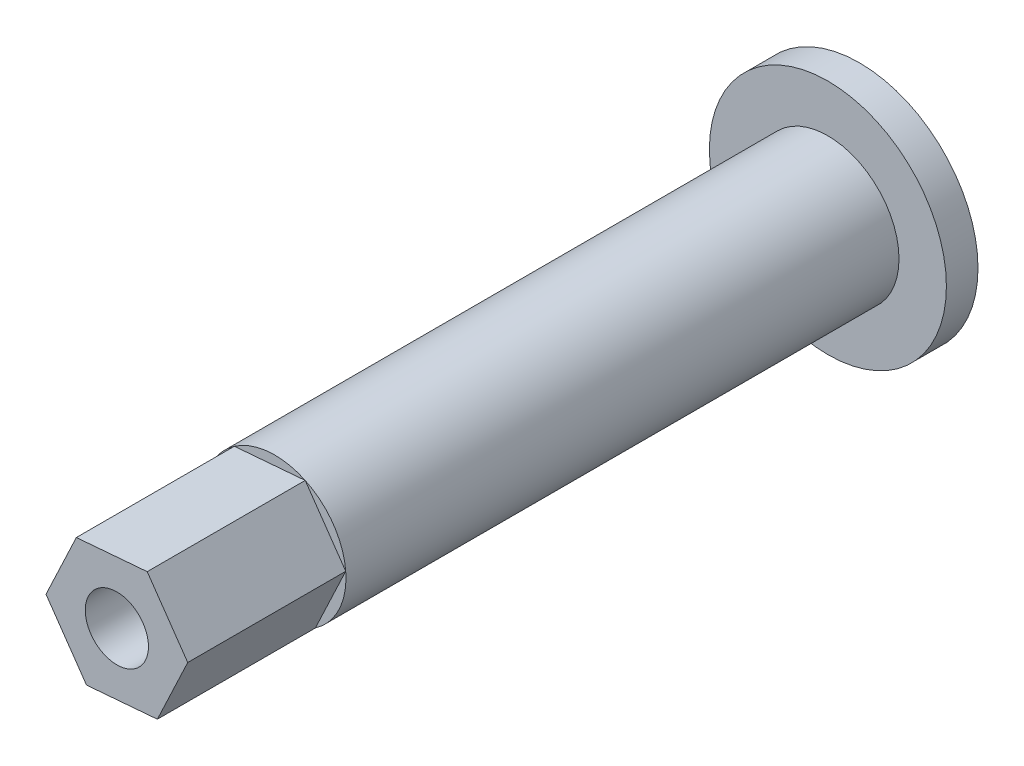
from build123d import *

# Parameters (mm, degrees)
SKETCH1_R           = 4.5
BOSS_EXTRUDE1_DEPTH = 10
BOSS_EXTRUDE2_START = 2
SKETCH2_R           = 7.5
BOSS_EXTRUDE2_DEPTH = 2
SKETCH3_R           = 4.5
BOSS_EXTRUDE3_DEPTH = 25
BOSS_EXTRUDE4_DEPTH = 10
SKETCH5_R           = 2
CUT_EXTRUDE1_DEPTH  = 6


with BuildPart() as part:
    # Sketch1 → Boss-Extrude1 (new body)
    with BuildSketch(Plane.XY):
        Circle(SKETCH1_R)
        with BuildLine():
            Line((-1.85, 1.966596044), (-1.85, -1.966596044))
            ThreePointArc((-1.85, -1.966596044), (0, -2.7), (1.85, -1.966596044))
            Line((1.85, -1.966596044), (1.85, 1.966596044))
            ThreePointArc((1.85, 1.966596044), (1.851058142, 1.9656001), (1.852115749, 1.964603587))
            ThreePointArc((1.852115749, 1.964603587), (0.001453124, 2.699999609), (-1.85, 1.966596044))
        make_face(mode=Mode.SUBTRACT)
    extrude(amount=BOSS_EXTRUDE1_DEPTH)

    # Sketch2 → Boss-Extrude2 (add)
    with BuildSketch(Plane(origin=(0, 0, 0), x_dir=(-1, 0, 0), z_dir=(0, 0, -1)).offset(BOSS_EXTRUDE2_START)):
        Circle(SKETCH2_R)
        with BuildLine():
            Line((1.85, 1.966596044), (1.85, -1.966596044))
            ThreePointArc((1.85, -1.966596044), (0, -2.7), (-1.85, -1.966596044))
            Line((-1.85, -1.966596044), (-1.85, 1.966596044))
            ThreePointArc((-1.85, 1.966596044), (0, 2.7), (1.85, 1.966596044))
        make_face(mode=Mode.SUBTRACT)
    extrude(amount=-BOSS_EXTRUDE2_DEPTH)

    # Sketch3 → Boss-Extrude3 (add)
    with BuildSketch(Plane.XY.offset(10)):
        Circle(SKETCH3_R)
    extrude(amount=BOSS_EXTRUDE3_DEPTH)

    # Sketch4 → Boss-Extrude4 (add)
    with BuildSketch(Plane.XY.offset(35)):
        Polygon((1.920788906, 4.069468022), (-2.563868233, 3.698185999), (-4.48465714, -0.371282023), (-1.920788906, -4.069468022), (2.563868233, -3.698185999), (4.48465714, 0.371282023), align=None)
    extrude(amount=BOSS_EXTRUDE4_DEPTH)

    # Sketch5 → Cut-Extrude1 (cut)
    with BuildSketch(Plane.XY.offset(45)):
        Circle(SKETCH5_R)
    extrude(amount=-CUT_EXTRUDE1_DEPTH, mode=Mode.SUBTRACT)


solid = part.part
